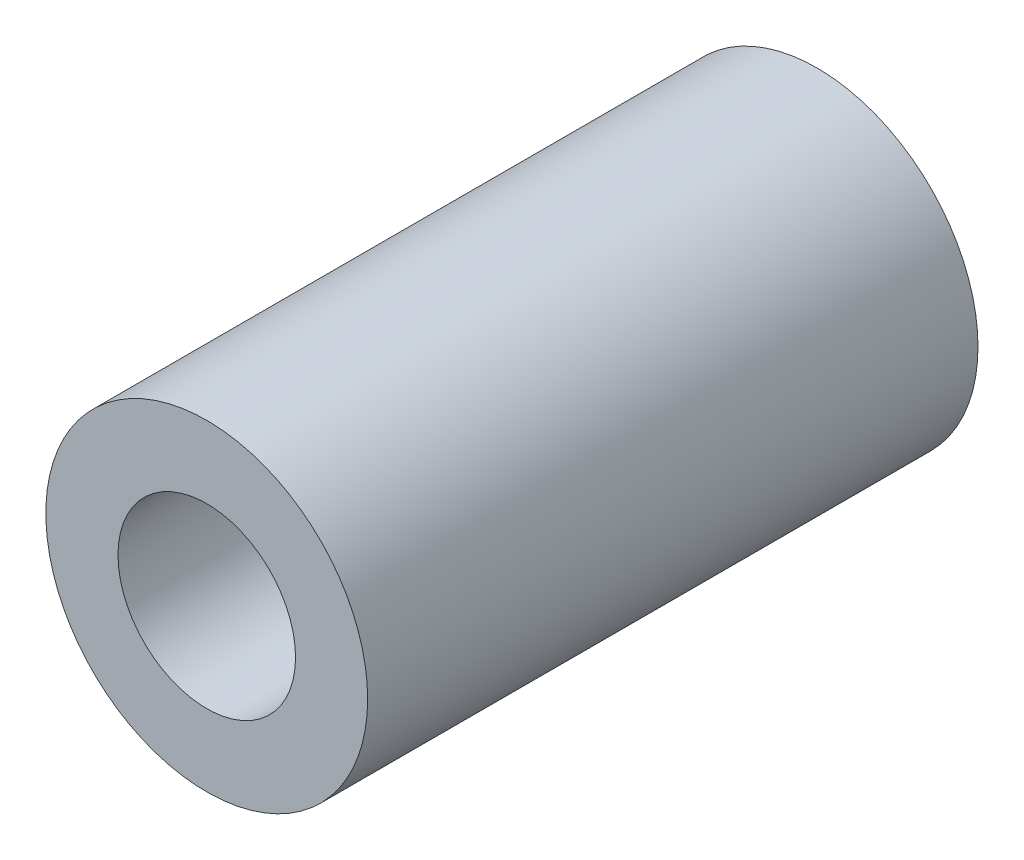
from build123d import *

# Parameters (mm, degrees)
SZKIC1_R                    = 2.9
DODANIE_WYCI_GNI_CIE1_DEPTH = 11
SZKIC2_R                    = 1.6
WYTNIJ_WYCI_GNI_CIE1_DEPTH  = 12.739676316


with BuildPart() as part:
    # Szkic1 → Dodanie-wyciągnięcie1 (new body)
    with BuildSketch(Plane.XY):
        Circle(SZKIC1_R)
    extrude(amount=DODANIE_WYCI_GNI_CIE1_DEPTH)

    # Szkic2 → Wytnij-wyciągnięcie1 (cut, through all)
    with BuildSketch(Plane.XY.offset(11)):
        Circle(SZKIC2_R)
    extrude(amount=-WYTNIJ_WYCI_GNI_CIE1_DEPTH, mode=Mode.SUBTRACT)


solid = part.part
